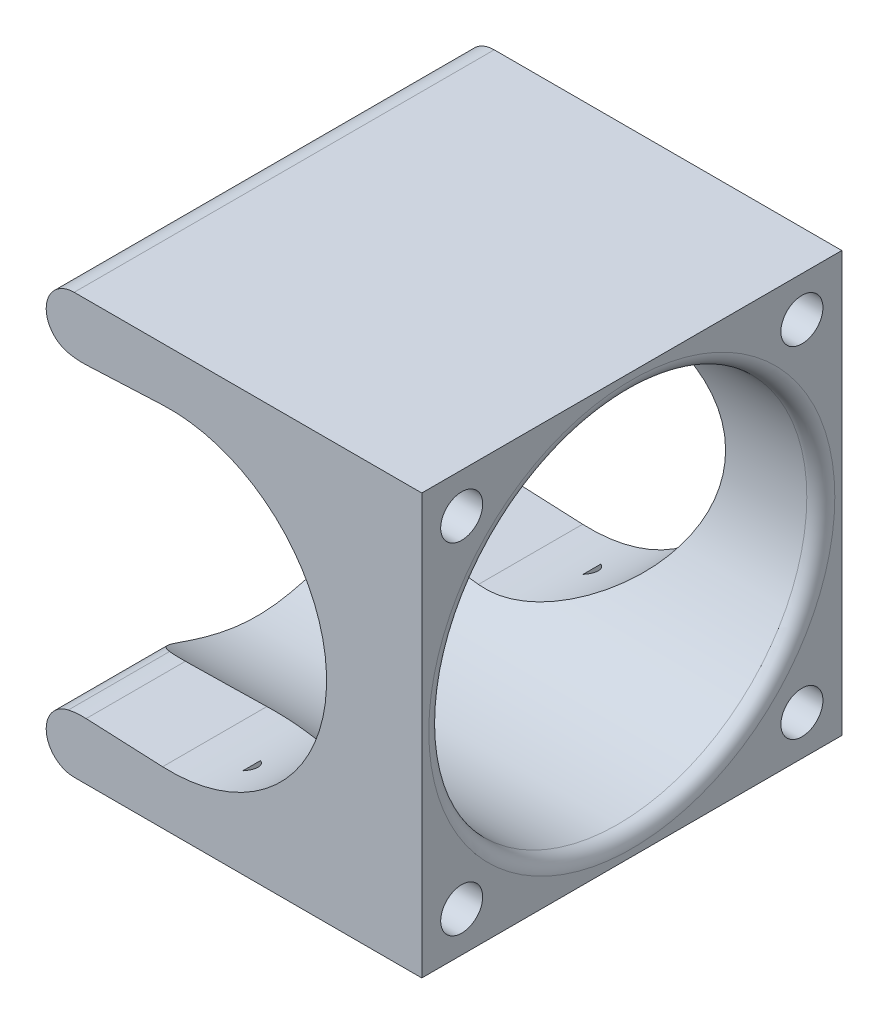
from build123d import *

# Parameters (mm, degrees)
EXTRUDE_1_DEPTH     = 30
SKETCH_2_R          = 13.5
CUT_EXTRUDE_1_DEPTH = 43.950128538
SKETCH_3_R          = 1.5
CUT_EXTRUDE_2_DEPTH = 15
FILLET_1_R          = 1


with BuildPart() as part:
    # 草图1 → 凸台-拉伸1 (new body)
    with BuildSketch(Plane.XY):
        with BuildLine():
            Line((18, -15), (-6.827477359, -15))
            ThreePointArc((-6.827477359, -15), (-8.816387423, -13.210325367), (-7.245795599, -11.04423676))
            ThreePointArc((-7.245795599, -11.04423676), (-6.612183742, -10.950663366), (-5.971808444, -10.938854713))
            Line((-5.971808444, -10.938854713), (-0.511149085, -11.18832993))
            ThreePointArc((-0.511149085, -11.18832993), (11.2, 0), (-0.511149085, 11.18832993))
            Line((-0.511149085, 11.18832993), (-5.971808444, 10.938854713))
            ThreePointArc((-5.971808444, 10.938854713), (-6.612183742, 10.950663366), (-7.245795599, 11.04423676))
            ThreePointArc((-7.245795599, 11.04423676), (-8.816387423, 13.210325367), (-6.827477359, 15))
            Line((-6.827477359, 15), (18, 15))
            Line((18, 15), (18, -15))
        make_face()
    extrude(amount=EXTRUDE_1_DEPTH)

    # 草图2 → 切除-拉伸1 (cut, through all)
    with BuildSketch(Plane(origin=(18, 0, 0), x_dir=(0, 0, -1), z_dir=(1, 0, 0))):
        with Locations((-15, 0)):
            Circle(SKETCH_2_R)
    extrude(amount=-CUT_EXTRUDE_1_DEPTH, mode=Mode.SUBTRACT)

    # 草图3 → 切除-拉伸2 (cut)
    with BuildSketch(Plane(origin=(18, 0, 0), x_dir=(0, 0, -1), z_dir=(1, 0, 0))):
        with Locations((-27.15, 12.15)):
            Circle(SKETCH_3_R)
        with Locations((-2.85, 12.15)):
            Circle(SKETCH_3_R)
        with Locations((-2.85, -12.15)):
            Circle(SKETCH_3_R)
        with Locations((-27.15, -12.15)):
            Circle(SKETCH_3_R)
    extrude(amount=-CUT_EXTRUDE_2_DEPTH, mode=Mode.SUBTRACT)

    # 圆角1
    fillet_1_edges = [part.edges().sort_by_distance(p)[0] for p in [
        (18, 0, 28.5),
    ]]
    fillet(fillet_1_edges, radius=FILLET_1_R)


solid = part.part
